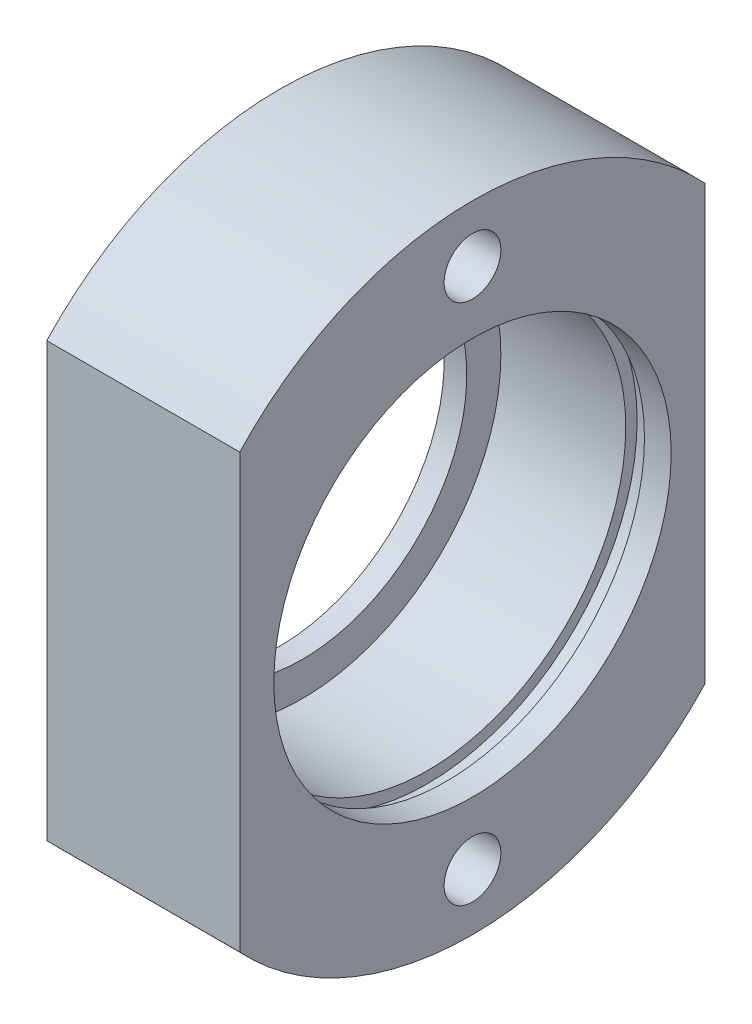
from build123d import *

# Parameters (mm, degrees)
CUT_EXTRUDE1_DEPTH = 44.092922853
TAPPED_HOLE1_D     = 5


with BuildPart() as part:
    # Sketch1 → Revolve1 (revolve)
    with BuildSketch(Plane.XY, mode=Mode.PRIVATE) as revolve1_sk:
        Polygon((0, 28), (17, 28), (17, 17.5), (14.65, 17.5), (14.65, 18.5), (13, 18.5), (13, 17.5), (2, 17.5), (2, 14.5), (0, 14.5), align=None)
    revolve(revolve1_sk.sketch.rotate(Axis((0, 0, 0), (1, 0, 0)), 90), axis=Axis((0, 0, 0), (1, 0, 0)))

    # Sketch2 → Cut-Extrude1 (cut, through all)
    with BuildSketch(Plane(origin=(17, 0, 0), x_dir=(0, 0, -1), z_dir=(1, 0, 0))):
        with BuildLine():
            Line((-20.5, 19.072231123), (-20.5, -19.072231123))
            ThreePointArc((-20.5, -19.072231123), (-28, 0), (-20.5, 19.072231123))
        make_face()
        with BuildLine():
            Line((20.5, 19.072231123), (20.5, -19.072231123))
            ThreePointArc((20.5, -19.072231123), (28, 0), (20.5, 19.072231123))
        make_face()
    extrude(amount=-CUT_EXTRUDE1_DEPTH, mode=Mode.SUBTRACT)

    # Tapped Hole1 (through all)
    with Locations(Plane(origin=(17, 0, 0), x_dir=(0, 0, -1), z_dir=(1, 0, 0))):
        with Locations((0, 23), (0, -23)):
            Hole(TAPPED_HOLE1_D / 2)


solid = part.part
